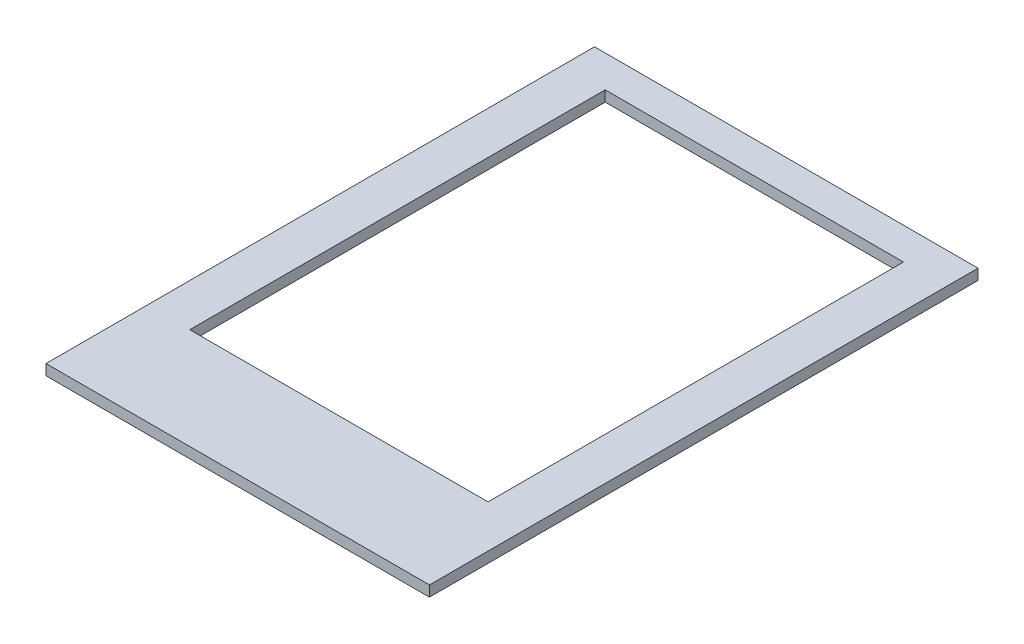
from build123d import *

# Parameters (mm, degrees)
SKETCH1_W           = 457.2
SKETCH1_H           = 654.05
SKETCH1_W_2         = 355.6
SKETCH1_H_2         = 495.3
BOSS_EXTRUDE1_DEPTH = 12.7


with BuildPart() as part:
    # Sketch1 → Boss-Extrude1 (new body)
    with BuildSketch(Plane(origin=(0, 0, 0), x_dir=(1, 0, 0), z_dir=(0, 1, 0))):
        with Locations((228.6, 327.025)):
            Rectangle(SKETCH1_W, SKETCH1_H)
        with Locations((228.6, 368.3)):
            Rectangle(SKETCH1_W_2, SKETCH1_H_2, mode=Mode.SUBTRACT)
    extrude(amount=BOSS_EXTRUDE1_DEPTH)


solid = part.part
